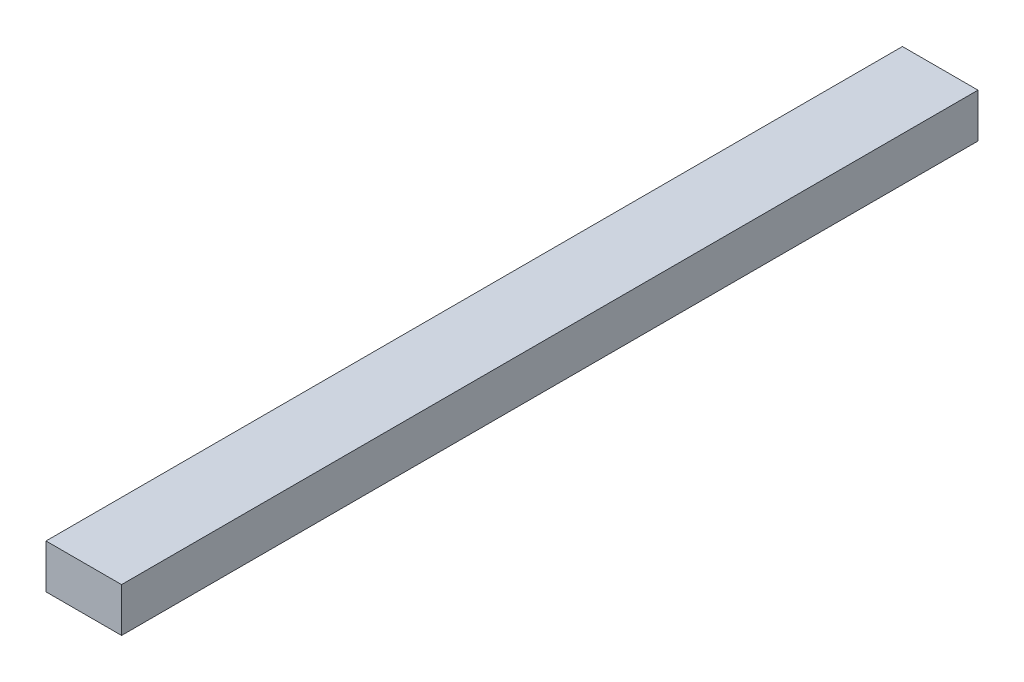
from build123d import *

# Parameters (mm, degrees)
SKETCH1_W           = 38.1
SKETCH1_H           = 22.225
BOSS_EXTRUDE1_DEPTH = 431.8


with BuildPart() as part:
    # Sketch1 → Boss-Extrude1 (new body)
    with BuildSketch(Plane.XY):
        with Locations((19.05, 11.1125)):
            Rectangle(SKETCH1_W, SKETCH1_H)
    extrude(amount=BOSS_EXTRUDE1_DEPTH)


solid = part.part
